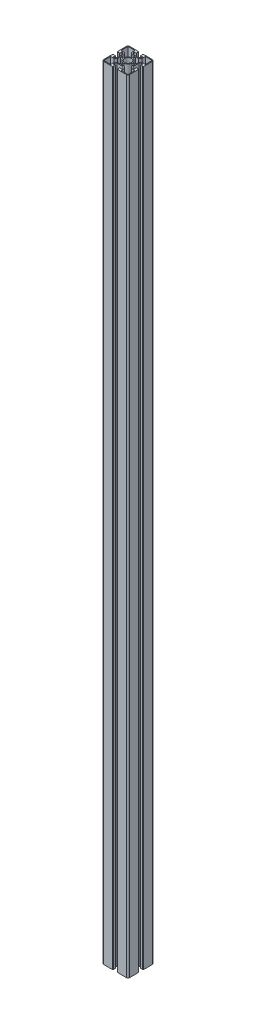
from build123d import *

# Parameters (mm, degrees)
SKETCH_1_R      = 8
EXTRUDE_1_DEPTH = 1800


with BuildPart() as part:
    # 草图1 → 凸台-拉伸1 (new body)
    with BuildSketch(Plane(origin=(0, 0, 0), x_dir=(1, 0, 0), z_dir=(0, 1, 0))):
        with BuildLine():
            Line((-30, 5.999999999), (-28.5, 5.999999999))
            Line((-28.5, 5.999999999), (-28.5, 4.999999999))
            Line((-28.5, 4.999999999), (-24, 4.999999999))
            Line((-24, 4.999999999), (-24, 9.999999999))
            Line((-24, 9.999999999), (-21, 9.999999999))
            Line((-21, 9.999999999), (-18, 6.999999999))
            Line((-18, 6.999999999), (-18, -7.000000001))
            Line((-18, -7.000000001), (-21, -10.000000001))
            Line((-21, -10.000000001), (-24, -10.000000001))
            Line((-24, -10.000000001), (-24, -5.000000001))
            Line((-24, -5.000000001), (-28.5, -5.000000001))
            Line((-28.5, -5.000000001), (-28.5, -6.000000001))
            Line((-28.5, -6.000000001), (-30, -6.000000001))
            Line((-30, -6.000000001), (-30, -26.000000001))
            ThreePointArc((-30, -26.000000001), (-28.828427125, -28.828427126), (-26, -30.000000001))
            Line((-26, -30.000000001), (-6, -30.000000001))
            Line((-6, -30.000000001), (-6, -28.500000001))
            Line((-6, -28.500000001), (-5, -28.500000001))
            Line((-5, -28.500000001), (-5, -24.000000001))
            Line((-5, -24.000000001), (-10, -24.000000001))
            Line((-10, -24.000000001), (-10, -21.000000001))
            Line((-10, -21.000000001), (-7, -18.000000001))
            Line((-7, -18.000000001), (7, -18.000000001))
            Line((7, -18.000000001), (10, -21.000000001))
            Line((10, -21.000000001), (10, -24.000000001))
            Line((10, -24.000000001), (5, -24.000000001))
            Line((5, -24.000000001), (5, -28.500000001))
            Line((5, -28.500000001), (6, -28.500000001))
            Line((6, -28.500000001), (6, -30.000000001))
            Line((6, -30.000000001), (26, -30.000000001))
            ThreePointArc((26, -30.000000001), (28.828427125, -28.828427126), (30, -26.000000001))
            Line((30, -26.000000001), (30, -6.000000001))
            Line((30, -6.000000001), (28.5, -6.000000001))
            Line((28.5, -6.000000001), (28.5, -5.000000001))
            Line((28.5, -5.000000001), (24, -5.000000001))
            Line((24, -5.000000001), (24, -10.000000001))
            Line((24, -10.000000001), (21, -10.000000001))
            Line((21, -10.000000001), (18, -7.000000001))
            Line((18, -7.000000001), (18, 6.999999999))
            Line((18, 6.999999999), (21, 9.999999999))
            Line((21, 9.999999999), (24, 9.999999999))
            Line((24, 9.999999999), (24, 4.999999999))
            Line((24, 4.999999999), (28.5, 4.999999999))
            Line((28.5, 4.999999999), (28.5, 5.999999999))
            Line((28.5, 5.999999999), (30, 5.999999999))
            Line((30, 5.999999999), (30, 25.999999999))
            ThreePointArc((30, 25.999999999), (28.828427125, 28.828427124), (26, 29.999999999))
            Line((26, 29.999999999), (6, 29.999999999))
            Line((6, 29.999999999), (6, 28.499999999))
            Line((6, 28.499999999), (5, 28.499999999))
            Line((5, 28.499999999), (5, 23.999999999))
            Line((5, 23.999999999), (10, 23.999999999))
            Line((10, 23.999999999), (10, 20.999999999))
            Line((10, 20.999999999), (7, 17.999999999))
            Line((7, 17.999999999), (-7, 17.999999999))
            Line((-7, 17.999999999), (-10, 20.999999999))
            Line((-10, 20.999999999), (-10, 23.999999999))
            Line((-10, 23.999999999), (-5, 23.999999999))
            Line((-5, 23.999999999), (-5, 28.499999999))
            Line((-5, 28.499999999), (-6, 28.499999999))
            Line((-6, 28.499999999), (-6, 29.999999999))
            Line((-6, 29.999999999), (-26.000000001, 29.999999999))
            ThreePointArc((-26.000000001, 29.999999999), (-28.828427125, 28.828427123), (-30, 25.999999999))
            Line((-30, 25.999999999), (-30, 5.999999999))
        make_face()
        with Locations(Location((0, 0, 0), (0, 0, 270))):
            Circle(SKETCH_1_R, mode=Mode.SUBTRACT)
        with BuildLine():
            Line((-16, 1), (-9.949874371, 1))
            ThreePointArc((-9.949874371, 1), (-7.071067812, 7.071067811), (-1.000000001, 9.949874371))
            Line((-1.000000001, 9.949874371), (-1.000000001, 16))
            Line((-1.000000001, 16), (-7.828427125, 16))
            Line((-7.828427125, 16), (-12, 20.171572875))
            Line((-12, 20.171572875), (-12, 28))
            Line((-12, 28), (-28, 28))
            Line((-28, 28), (-28, 12))
            Line((-28, 12), (-20.171572875, 12))
            Line((-20.171572875, 12), (-16, 7.828427125))
            Line((-16, 7.828427125), (-16, 1))
        make_face(mode=Mode.SUBTRACT)
        with BuildLine():
            Line((1, 9.949874371), (1, 16))
            Line((1, 16), (7.828427125, 16))
            Line((7.828427125, 16), (12, 20.171572875))
            Line((12, 20.171572875), (12, 28))
            Line((12, 28), (28, 28))
            Line((28, 28), (28, 12.000000001))
            Line((28, 12.000000001), (20.171572875, 12.000000001))
            Line((20.171572875, 12.000000001), (16, 7.828427126))
            Line((16, 7.828427126), (16, 1.000000001))
            Line((16, 1.000000001), (9.949874371, 1.000000001))
            ThreePointArc((9.949874371, 1.000000001), (7.071067811, 7.071067812), (1, 9.949874371))
        make_face(mode=Mode.SUBTRACT)
        with BuildLine():
            Line((9.949874371, -1), (16, -1))
            Line((16, -1), (16, -7.828427125))
            Line((16, -7.828427125), (20.171572875, -12))
            Line((20.171572875, -12), (28.000000001, -12))
            Line((28.000000001, -12), (28.000000001, -28))
            Line((28.000000001, -28), (12.000000001, -28))
            Line((12.000000001, -28), (12.000000001, -20.171572875))
            Line((12.000000001, -20.171572875), (7.828427126, -16))
            Line((7.828427126, -16), (1.000000001, -16))
            Line((1.000000001, -16), (1.000000001, -9.949874371))
            ThreePointArc((1.000000001, -9.949874371), (7.071067812, -7.071067811), (9.949874371, -1))
        make_face(mode=Mode.SUBTRACT)
        with BuildLine():
            Line((-1, -9.949874371), (-1, -16.000000001))
            Line((-1, -16.000000001), (-7.828427125, -16.000000001))
            Line((-7.828427125, -16.000000001), (-12, -20.171572876))
            Line((-12, -20.171572876), (-12, -28.000000001))
            Line((-12, -28.000000001), (-28, -28.000000001))
            Line((-28, -28.000000001), (-28, -12.000000001))
            Line((-28, -12.000000001), (-20.171572875, -12.000000001))
            Line((-20.171572875, -12.000000001), (-16, -7.828427126))
            Line((-16, -7.828427126), (-16, -1.000000001))
            Line((-16, -1.000000001), (-9.949874371, -1.000000001))
            ThreePointArc((-9.949874371, -1.000000001), (-7.071067811, -7.071067812), (-1, -9.949874371))
        make_face(mode=Mode.SUBTRACT)
    extrude(amount=EXTRUDE_1_DEPTH)


solid = part.part
